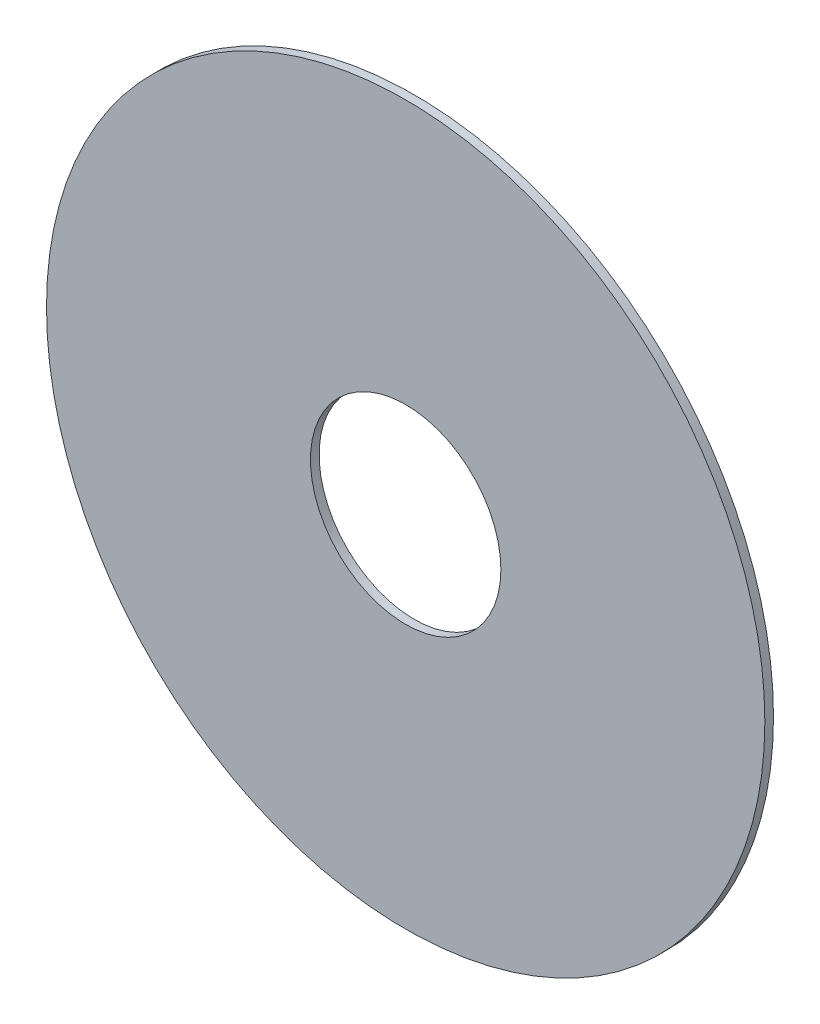
from build123d import *

# Parameters (mm, degrees)
SKETCH_2_R      = 41.5
SKETCH_2_R_2    = 11
EXTRUDE_1_DEPTH = 1


with BuildPart() as part:
    # 草图2 → 凸台-拉伸1 (new body)
    with BuildSketch(Plane.XY.offset(270)):
        with Locations((-196.078642011, 135.377138865)):
            Circle(SKETCH_2_R)
        with Locations((-196.078642011, 135.377138865)):
            Circle(SKETCH_2_R_2, mode=Mode.SUBTRACT)
    extrude(amount=EXTRUDE_1_DEPTH)


solid = part.part
